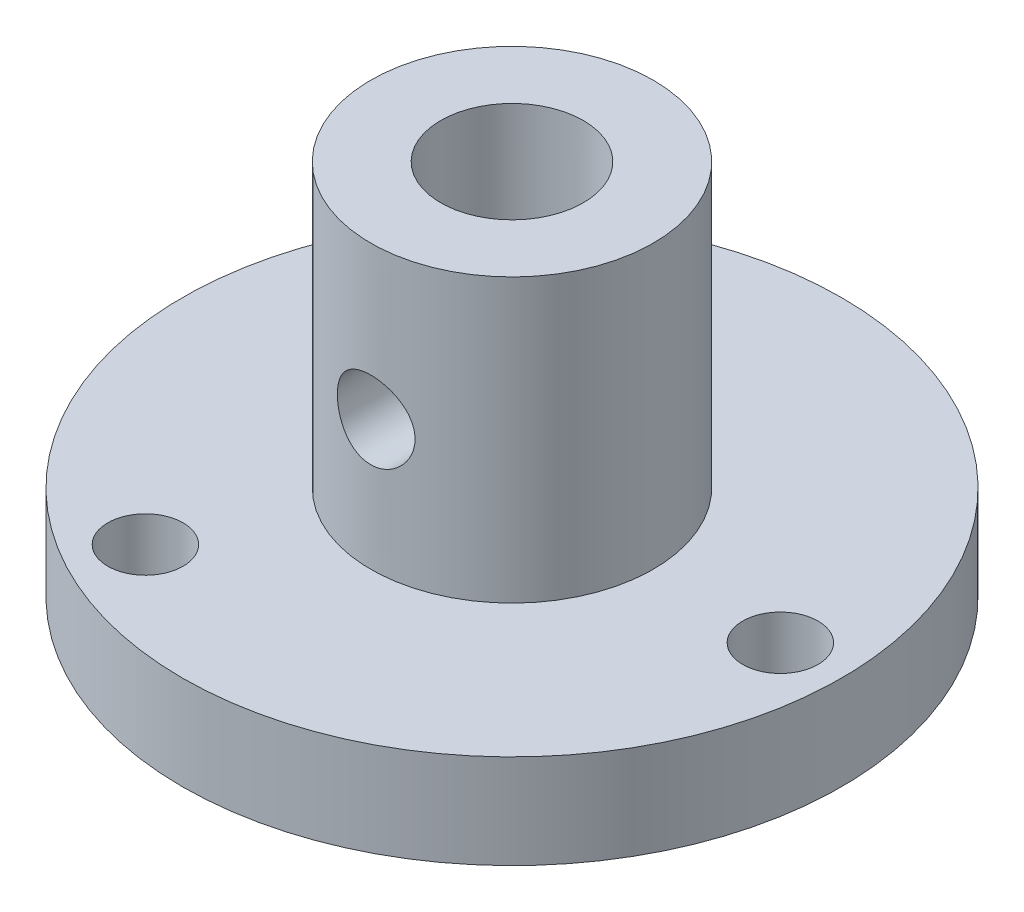
from build123d import *

# Parameters (mm, degrees)
ESQUISSE2_R             = 1.6
ENL_V_MAT_EXTRU_1_DEPTH = 26.455844123
ESQUISSE3_R             = 1.65
ENL_V_MAT_EXTRU_2_DEPTH = 30.189039039


with BuildPart() as part:
    # Esquisse1 → Révolution1 (revolve)
    with BuildSketch(Plane.XY, mode=Mode.PRIVATE) as r_volution1_sk:
        Polygon((-3.03, 0), (-3.03, 16), (-6, 16), (-6, 4), (-14, 4), (-14, 0), align=None)
    revolve(r_volution1_sk.sketch.rotate(Axis((0, 0, 0), (0, 1, 0)), 270), axis=Axis((0, 0, 0), (0, 1, 0)))

    # Esquisse2 → Enlèv. mat.-Extru.1 (cut, through all)
    with BuildSketch(Plane.XZ):
        with Locations(Location((11.4, 0, 0), (0, 0, 270))):
            Circle(ESQUISSE2_R)
        with Locations(Location((-5.7, -9.872689603, 0), (0, 0, 270))):
            Circle(ESQUISSE2_R)
        with Locations(Location((-5.7, 9.872689603, 0), (0, 0, 270))):
            Circle(ESQUISSE2_R)
    extrude(amount=-ENL_V_MAT_EXTRU_1_DEPTH, mode=Mode.SUBTRACT)

    # Esquisse3 → Enlèv. mat.-Extru.2 (cut, through all)
    with BuildSketch(Plane.XY.offset(6)):
        with Locations((0, 9.5)):
            Circle(ESQUISSE3_R)
    extrude(amount=-ENL_V_MAT_EXTRU_2_DEPTH, mode=Mode.SUBTRACT)


solid = part.part
